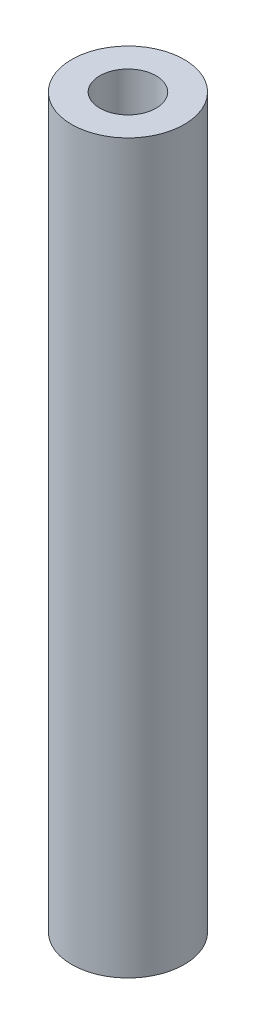
from build123d import *

# Parameters (mm, degrees)
SKETCH1_R           = 6.35
SKETCH1_R_2         = 3.175
BOSS_EXTRUDE1_DEPTH = 82.042


with BuildPart() as part:
    # Sketch1 → Boss-Extrude1 (new body)
    with BuildSketch(Plane(origin=(0, 0, 0), x_dir=(1, 0, 0), z_dir=(0, 1, 0))):
        with Locations(Location((0, 0, 0), (0, 0, 270))):
            Circle(SKETCH1_R)
        with Locations(Location((0, 0, 0), (0, 0, 270))):
            Circle(SKETCH1_R_2, mode=Mode.SUBTRACT)
    extrude(amount=BOSS_EXTRUDE1_DEPTH)


solid = part.part
